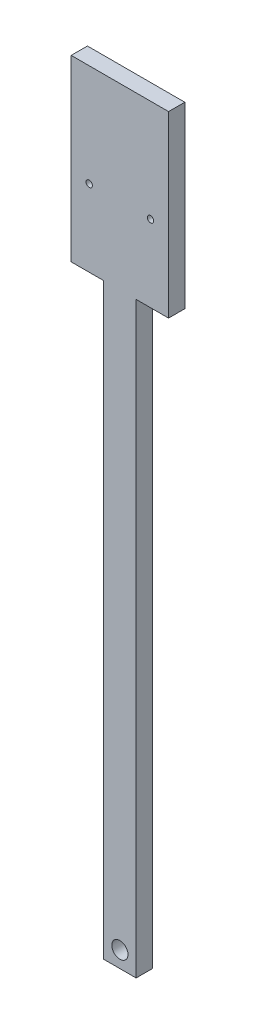
from build123d import *

# Parameters (mm, degrees)
CROQUIS1_W                      = 12.7
CROQUIS1_H                      = 6.35
SALIENTE_EXTRUIR1_DEPTH         = 150
CORTAR_EXTRUIR1_DEPTH           = 151.16791643
CORTAR_EXTRUIR1_DEPTH_BACK      = 151.16791643
CROQUIS2_R                      = 3.175
CROQUIS3_W                      = 38.1
CROQUIS3_H                      = 6.35
SALIENTE_EXTRUIR2_DEPTH         = 70
TALADRO_ROSCADO_M31_D           = 2.5
TALADRO_ROSCADO_M31_CSINK_D     = 3.05
TALADRO_ROSCADO_M31_CSINK_ANGLE = 90


with BuildPart() as part:
    # Croquis1 → Saliente-Extruir1 (new, symmetric)
    with BuildSketch(Plane(origin=(0, 0, 0), x_dir=(1, 0, 0), z_dir=(0, 1, 0))):
        Rectangle(CROQUIS1_W, CROQUIS1_H)
    extrude(amount=SALIENTE_EXTRUIR1_DEPTH, both=True)

    # Croquis2 → Cortar-Extruir1 (cut, two sides: drawn at the far end of the back side and taken through both)
    with BuildSketch(Plane.XY.offset(-CORTAR_EXTRUIR1_DEPTH_BACK)):
        with Locations((0, -143.65)):
            Circle(CROQUIS2_R)
    extrude(amount=CORTAR_EXTRUIR1_DEPTH + CORTAR_EXTRUIR1_DEPTH_BACK, mode=Mode.SUBTRACT)

    # Croquis3 → Saliente-Extruir2 (add)
    with BuildSketch(Plane(origin=(0, 150, 0), x_dir=(1, 0, 0), z_dir=(0, 1, 0))):
        Rectangle(CROQUIS3_W, CROQUIS3_H)
    extrude(amount=-SALIENTE_EXTRUIR2_DEPTH)

    # Taladro roscado M31 (through all)
    with Locations(Plane(origin=(0, 0, -3.175), x_dir=(-1, 0, 0), z_dir=(0, 0, -1))):
        with Locations((12, 110), (-12, 110)):
            CounterSinkHole(TALADRO_ROSCADO_M31_D / 2, TALADRO_ROSCADO_M31_CSINK_D / 2, counter_sink_angle=TALADRO_ROSCADO_M31_CSINK_ANGLE)


solid = part.part
